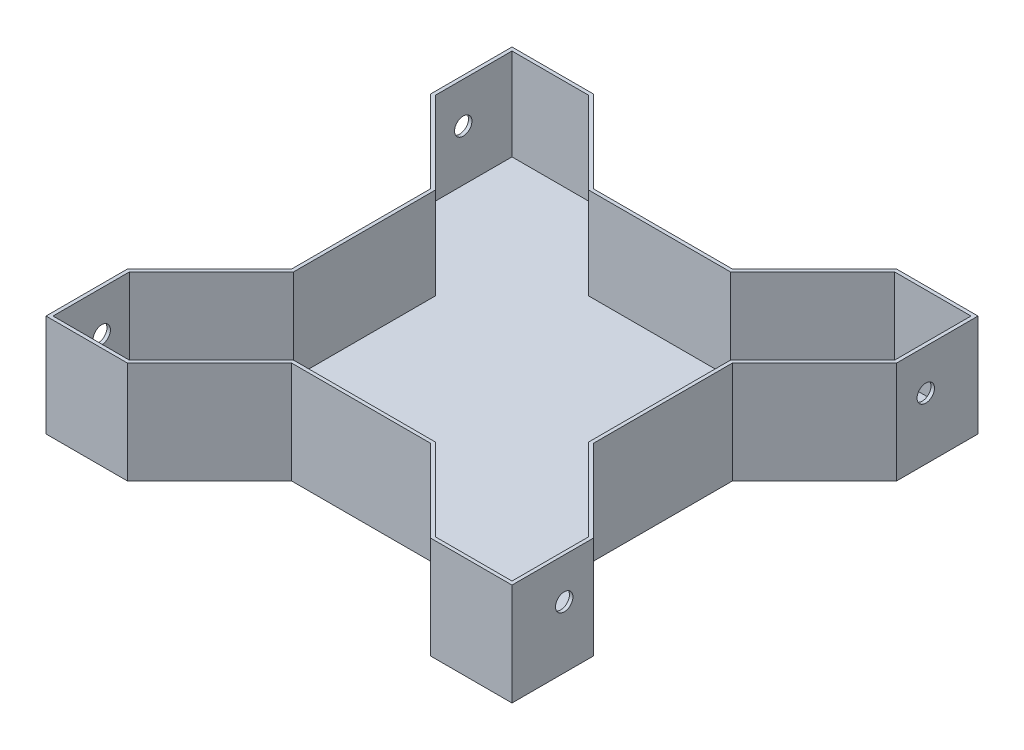
from build123d import *

# Parameters (mm, degrees)
BOSS_EXTRUDE1_DEPTH = 88
CUT_EXTRUDE1_DEPTH  = 79
SKETCH4_R           = 7.5
CUT_EXTRUDE2_DEPTH  = 47
SKETCH6_R           = 7.5
CUT_EXTRUDE4_DEPTH  = 47
CUT_EXTRUDE5_START  = -47
SKETCH7_R           = 7.5
CUT_EXTRUDE5_DEPTH  = 47
CUT_EXTRUDE6_START  = -47
SKETCH8_R           = 7.5
CUT_EXTRUDE6_DEPTH  = 47
CUT_EXTRUDE8_DEPTH  = 6


with BuildPart() as part:
    # Sketch1 → Boss-Extrude1 (new body)
    with BuildSketch(Plane(origin=(0, 0, 0), x_dir=(1, 0, 0), z_dir=(0, 1, 0))):
        Polygon((-161.642165003, 149.218305812), (-91.642165003, 149.218305812), (-20.931486885, 78.507627693), (99.068513115, 78.507627693), (169.779191234, 149.218305812), (239.779191234, 149.218305812), (239.779191234, 79.218305812), (169.068513115, 8.507627693), (169.068513115, -111.492372307), (239.779191234, -182.203050426), (239.779191234, -252.203050426), (169.779191234, -252.203050426), (99.068513115, -181.492372307), (-20.931486885, -181.492372307), (-91.642165003, -252.203050426), (-161.642165003, -252.203050426), (-161.642165003, -182.203050426), (-90.931486885, -111.492372307), (-90.931486885, 8.507627693), (-161.642165003, 79.218305812), align=None)
    extrude(amount=BOSS_EXTRUDE1_DEPTH)

    # Sketch3 → Cut-Extrude1 (cut)
    with BuildSketch(Plane(origin=(0, 88, 0), x_dir=(1, 0, 0), z_dir=(0, 1, 0))):
        Polygon((-158.642165003, 146.218305812), (-158.642165003, 80.460946499), (-87.931486885, 9.75026838), (-87.931486885, -112.735012994), (-158.642165003, -183.445691113), (-158.642165003, -249.203050426), (-92.88480569, -249.203050426), (-22.174127572, -178.492372307), (100.311153802, -178.492372307), (171.021831921, -249.203050426), (236.779191234, -249.203050426), (236.779191234, -183.445691113), (166.068513115, -112.735012994), (166.068513115, 9.75026838), (236.779191234, 80.460946499), (236.779191234, 146.218305812), (171.021831921, 146.218305812), (100.311153802, 75.507627693), (-22.174127572, 75.507627693), (-92.88480569, 146.218305812), align=None)
    extrude(amount=-CUT_EXTRUDE1_DEPTH, mode=Mode.SUBTRACT)

    # Sketch4 → Cut-Extrude2 (cut)
    with BuildSketch(Plane(origin=(239.779191234, 0, 0), x_dir=(0, 0, -1), z_dir=(1, 0, 0))):
        with Locations((-207.203050426, 53)):
            Circle(SKETCH4_R)
    extrude(amount=-CUT_EXTRUDE2_DEPTH, mode=Mode.SUBTRACT)

    # Sketch6 → Cut-Extrude4 (cut)
    with BuildSketch(Plane(origin=(239.779191234, 0, 0), x_dir=(0, 0, -1), z_dir=(1, 0, 0))):
        with Locations((104.218305812, 53)):
            Circle(SKETCH6_R)
    extrude(amount=-CUT_EXTRUDE4_DEPTH, mode=Mode.SUBTRACT)

    # Sketch7 → Cut-Extrude5 (cut)
    with BuildSketch(Plane.ZY.offset(161.642165003).offset(CUT_EXTRUDE5_START)):
        with Locations(Location((-104.218305812, 53, 0), (0, 0, 180))):
            Circle(SKETCH7_R)
    extrude(amount=CUT_EXTRUDE5_DEPTH, mode=Mode.SUBTRACT)

    # Sketch8 → Cut-Extrude6 (cut)
    with BuildSketch(Plane.ZY.offset(161.642165003).offset(CUT_EXTRUDE6_START)):
        with Locations(Location((207.203050426, 53, 0), (0, 0, 180))):
            Circle(SKETCH8_R)
    extrude(amount=CUT_EXTRUDE6_DEPTH, mode=Mode.SUBTRACT)

    # Sketch17 → Cut-Extrude8 (cut)
    with BuildSketch(Plane.XZ):
        Polygon((100.311153802, -75.507627693), (171.021831921, -146.218305812), (236.779191234, -146.218305812), (236.779191234, -80.460946499), (166.068513115, -9.75026838), (166.068513115, 112.735012994), (236.779191234, 183.445691113), (236.779191234, 249.203050426), (171.021831921, 249.203050426), (100.311153802, 178.492372307), (-22.174127572, 178.492372307), (-92.88480569, 249.203050426), (-158.642165003, 249.203050426), (-158.642165003, 183.445691113), (-87.931486885, 112.735012994), (-87.931486885, -9.75026838), (-158.642165003, -80.460946499), (-158.642165003, -146.218305812), (-92.88480569, -146.218305812), (-22.174127572, -75.507627693), align=None)
    extrude(amount=-CUT_EXTRUDE8_DEPTH, mode=Mode.SUBTRACT)


solid = part.part
